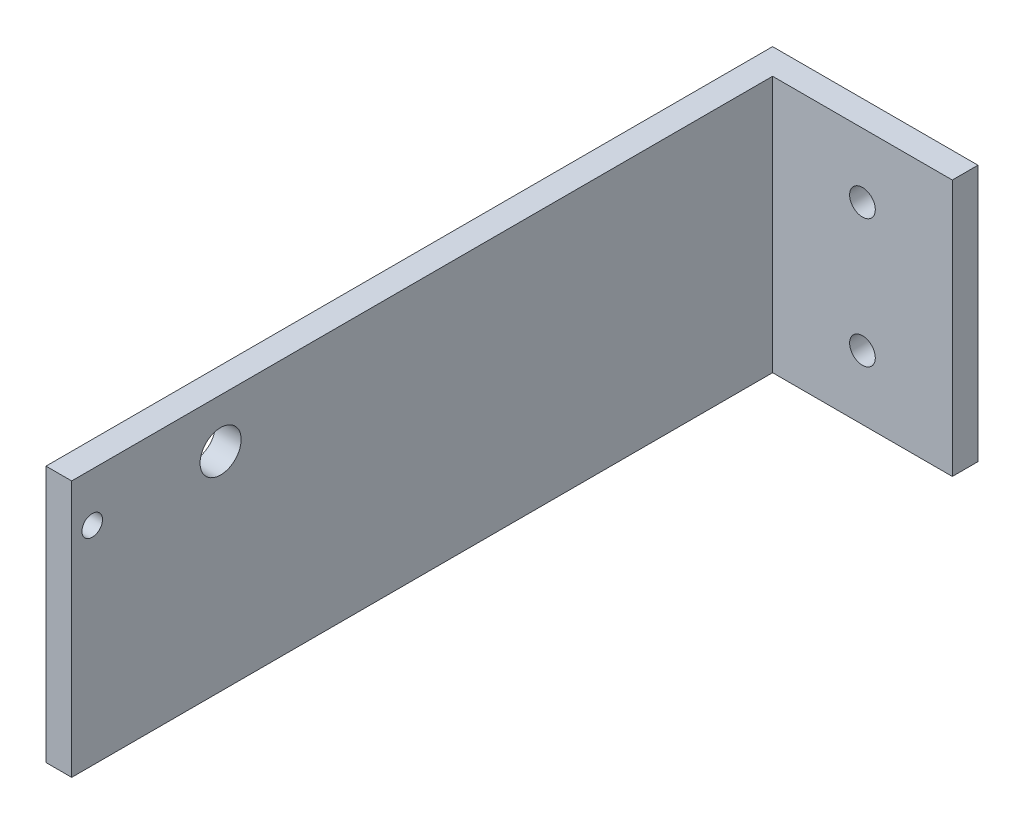
from build123d import *

# Parameters (mm, degrees)
BOSS_EXTRUDE2_DEPTH = 25
CUT_EXTRUDE2_REACH  = 149.893
SKETCH4_R           = 2
SKETCH4_R_2         = 4
CUT_EXTRUDE3_REACH  = 146.42
SKETCH5_R           = 2.5


with BuildPart() as part:
    # Sketch3 → Boss-Extrude2 (new, symmetric)
    with BuildSketch(Plane(origin=(0, 0, 0), x_dir=(1, 0, 0), z_dir=(0, 1, 0))):
        Polygon((0, 0), (5, 0), (5, 136.5), (40, 136.5), (40, 141.5), (0, 141.5), align=None)
    extrude(amount=BOSS_EXTRUDE2_DEPTH, both=True)

    # Sketch4 → Cut-Extrude2 (cut, up to next)
    with BuildSketch(Plane(origin=(5, 0, 0), x_dir=(0, 0, -1), z_dir=(1, 0, 0)), mode=Mode.PRIVATE) as cut_extrude2_sk1:
        with Locations((4, 15.5)):
            Circle(SKETCH4_R)
    cut_extrude2_tool1 = extrude(cut_extrude2_sk1.sketch, amount=-CUT_EXTRUDE2_REACH, mode=Mode.PRIVATE) & part.part
    # Sketch4 → Cut-Extrude2 (cut, up to next)
    with BuildSketch(Plane(origin=(5, 0, 0), x_dir=(0, 0, -1), z_dir=(1, 0, 0)), mode=Mode.PRIVATE) as cut_extrude2_sk2:
        with Locations((29, 15.5)):
            Circle(SKETCH4_R_2)
    cut_extrude2_tool2 = extrude(cut_extrude2_sk2.sketch, amount=-CUT_EXTRUDE2_REACH, mode=Mode.PRIVATE) & part.part
    add(cut_extrude2_tool1.solids().sort_by_distance((5, 15.5, -4))[0], mode=Mode.SUBTRACT)
    add(cut_extrude2_tool2.solids().sort_by_distance((5, 15.5, -29))[0], mode=Mode.SUBTRACT)

    # Sketch5 → Cut-Extrude3 (cut, up to next)
    with BuildSketch(Plane.XY.offset(-136.5), mode=Mode.PRIVATE) as cut_extrude3_sk1:
        with Locations((22.5, 12.5)):
            Circle(SKETCH5_R)
    cut_extrude3_tool1 = extrude(cut_extrude3_sk1.sketch, amount=-CUT_EXTRUDE3_REACH, mode=Mode.PRIVATE) & part.part
    # Sketch5 → Cut-Extrude3 (cut, up to next)
    with BuildSketch(Plane.XY.offset(-136.5), mode=Mode.PRIVATE) as cut_extrude3_sk2:
        with Locations((22.5, -12.5)):
            Circle(SKETCH5_R)
    cut_extrude3_tool2 = extrude(cut_extrude3_sk2.sketch, amount=-CUT_EXTRUDE3_REACH, mode=Mode.PRIVATE) & part.part
    add(cut_extrude3_tool1.solids().sort_by_distance((22.5, 12.5, -136.5))[0], mode=Mode.SUBTRACT)
    add(cut_extrude3_tool2.solids().sort_by_distance((22.5, -12.5, -136.5))[0], mode=Mode.SUBTRACT)


solid = part.part
